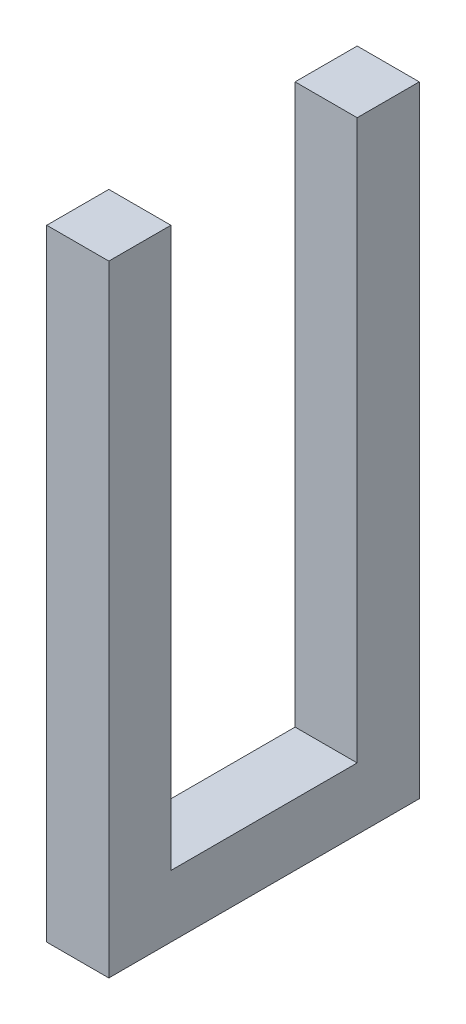
from build123d import *

# Parameters (mm, degrees)
SALIENTE_EXTRUIR1_DEPTH = 10


with BuildPart() as part:
    # Croquis1 → Saliente-Extruir1 (new body)
    with BuildSketch(Plane(origin=(0, 0, 0), x_dir=(0, 0, -1), z_dir=(1, 0, 0))):
        Polygon((0, 0), (0, 100), (10, 100), (10, 10), (40, 10), (40, 100), (50, 100), (50, 0), align=None)
    extrude(amount=SALIENTE_EXTRUIR1_DEPTH)


solid = part.part
